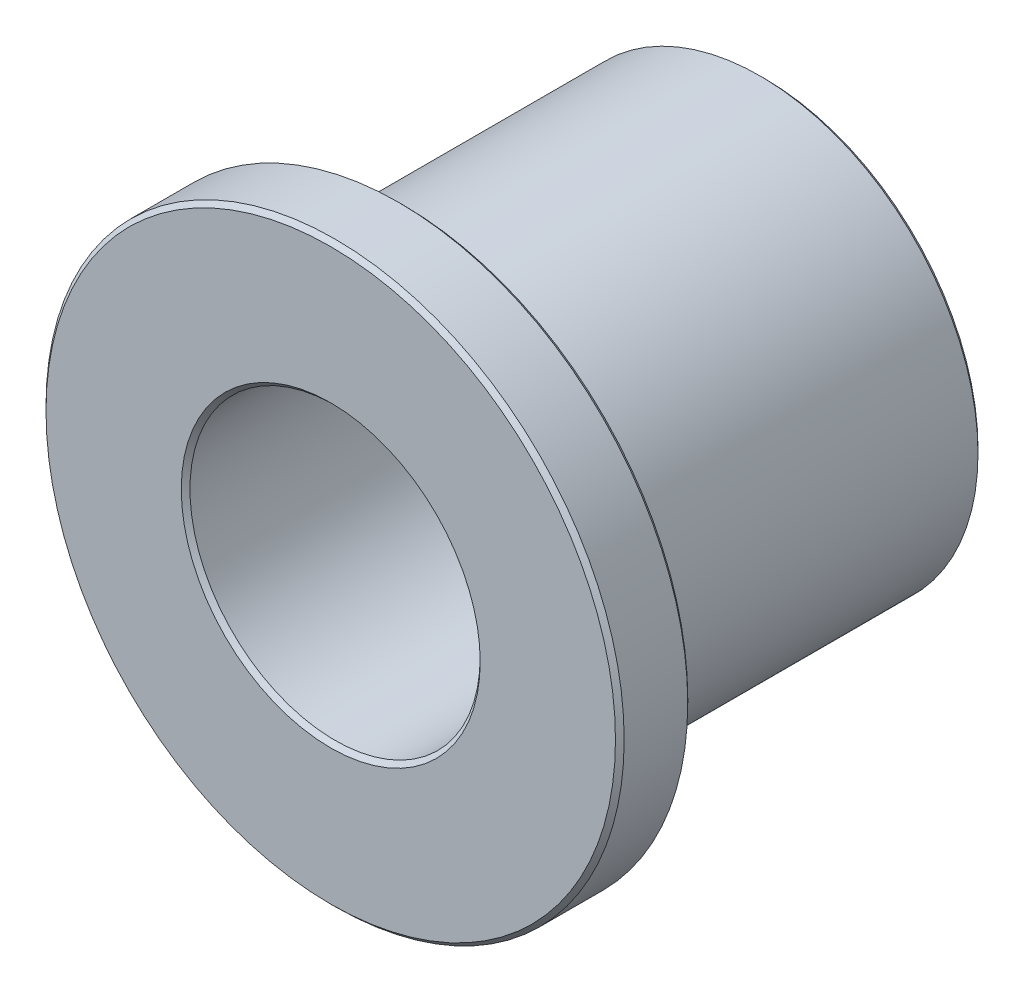
from build123d import *

# Parameters (mm, degrees)
BOSS_EXTRUDE1_START = 4.7625
SKETCH3_R           = 6.35
SKETCH3_R_2         = 3.1877
BOSS_EXTRUDE1_DEPTH = 1.5875
BOSS_EXTRUDE2_START = 3.175
SKETCH4_R           = 4.7879
SKETCH4_R_2         = 3.1877
BOSS_EXTRUDE2_DEPTH = 7.9375
CHAMFER1_SIZE       = 0.095631


with BuildPart() as part:
    # Sketch3 → Boss-Extrude1 (new body)
    with BuildSketch(Plane.XY.offset(BOSS_EXTRUDE1_START)):
        Circle(SKETCH3_R)
        Circle(SKETCH3_R_2, mode=Mode.SUBTRACT)
    extrude(amount=-BOSS_EXTRUDE1_DEPTH)

    # Sketch4 → Boss-Extrude2 (add)
    with BuildSketch(Plane.XY.offset(BOSS_EXTRUDE2_START)):
        Circle(SKETCH4_R)
        Circle(SKETCH4_R_2, mode=Mode.SUBTRACT)
    extrude(amount=-BOSS_EXTRUDE2_DEPTH)

    # Chamfer1
    chamfer1_edges = [part.edges().sort_by_distance(p)[0] for p in [
        (-3.1877, 0, -4.7625),
        (-4.7879, 0, 3.175),
        (-6.35, 0, 4.7625),
        (-6.35, 0, 3.175),
        (-3.1877, 0, 4.7625),
        (-4.7879, 0, -4.7625),
    ]]
    chamfer(chamfer1_edges, length=CHAMFER1_SIZE)


solid = part.part
